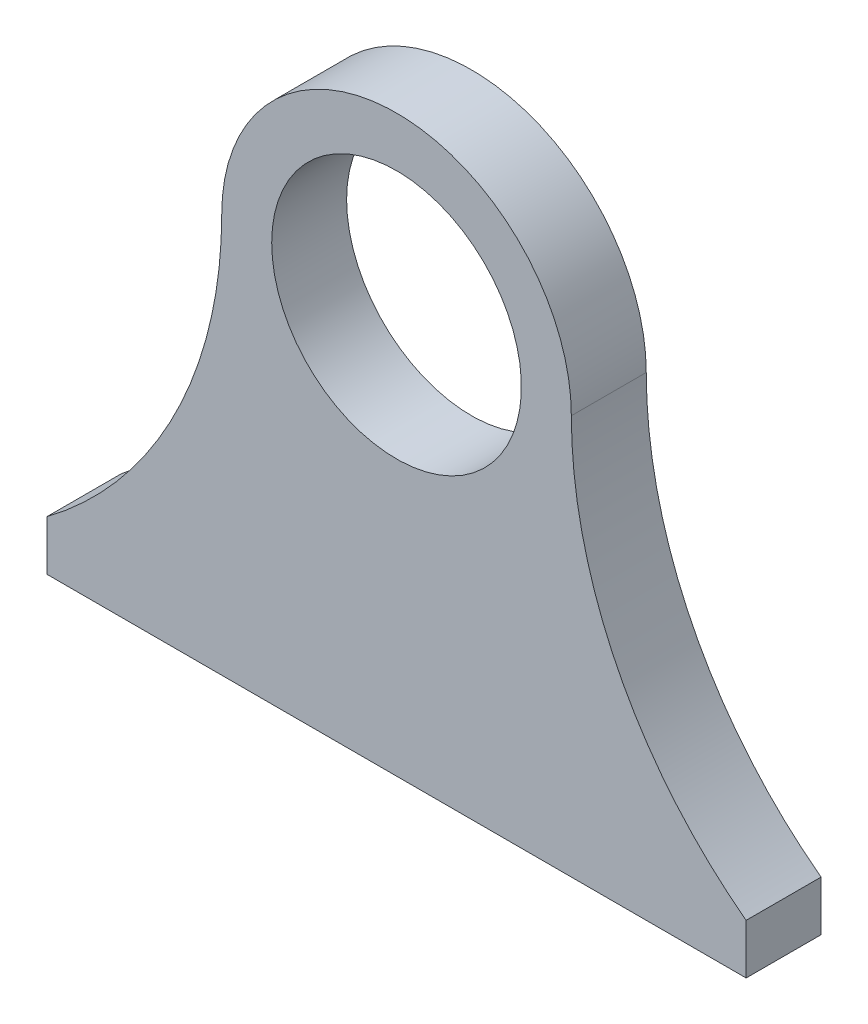
from build123d import *

# Parameters (mm, degrees)
SKETCH1_R           = 7.9375
BOSS_EXTRUDE1_DEPTH = 4.7625


with BuildPart() as part:
    # Sketch1 → Boss-Extrude1 (new body)
    with BuildSketch(Plane.XY):
        with BuildLine():
            ThreePointArc((11.1125, 0), (14.0454446, -12.4241527), (22.225, -22.225))
            Line((22.225, -22.225), (22.225, -25.4))
            Line((22.225, -25.4), (-22.225, -25.4))
            Line((-22.225, -25.4), (-22.225, -22.225))
            ThreePointArc((-22.225, -22.225), (-14.0454446, -12.4241527), (-11.1125, 0))
            ThreePointArc((-11.1125, 0), (0, 11.1125), (11.1125, 0))
        make_face()
        with Locations(Location((0, 0, 0), (0, 0, 180))):
            Circle(SKETCH1_R, mode=Mode.SUBTRACT)
    extrude(amount=BOSS_EXTRUDE1_DEPTH)


solid = part.part
